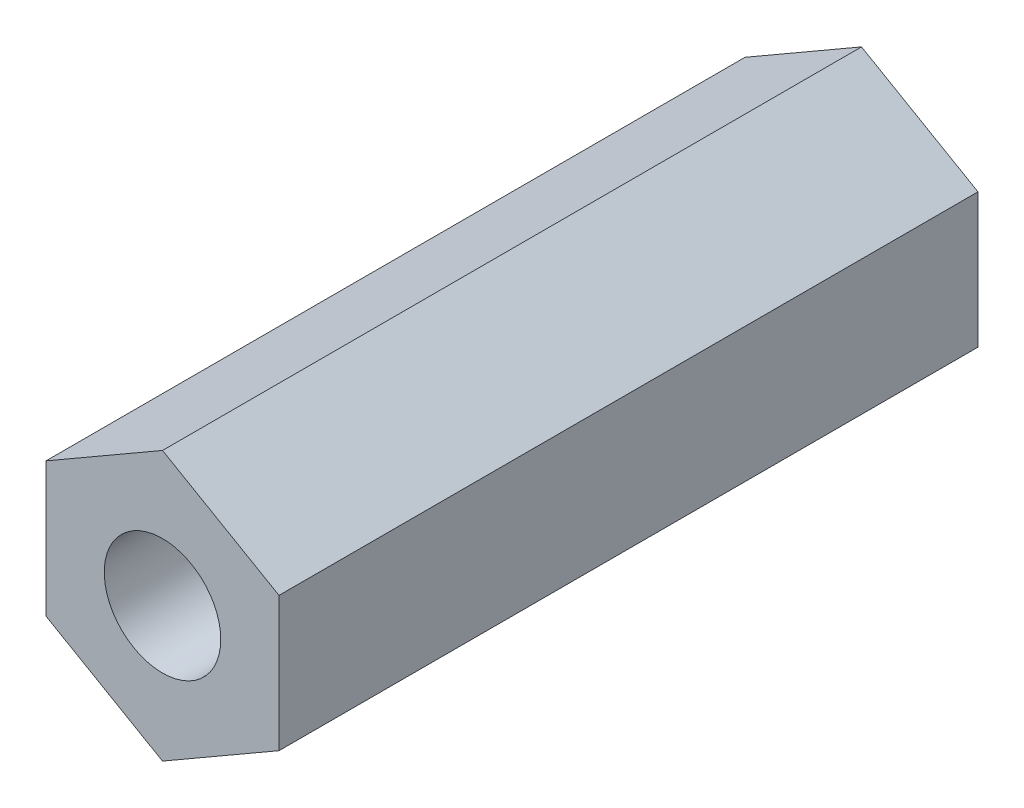
from build123d import *

# Parameters (mm, degrees)
EXTRUDE1_DEPTH      = 9
EXTRUDE1_DEPTH_BACK = 9
SKETCH1_R           = 1.5


with BuildPart() as part:
    # Sketch1 → Extrude1 (new, two sides: drawn at the far end of the back side and taken through both)
    with BuildSketch(Plane.XY.offset(-EXTRUDE1_DEPTH_BACK)):
        Polygon((0, 3.464101615), (-3, 1.732050808), (-3, -1.732050808), (0, -3.464101615), (3, -1.732050808), (3, 1.732050808), align=None)
        Circle(SKETCH1_R, mode=Mode.SUBTRACT)
    extrude(amount=EXTRUDE1_DEPTH + EXTRUDE1_DEPTH_BACK)


solid = part.part
